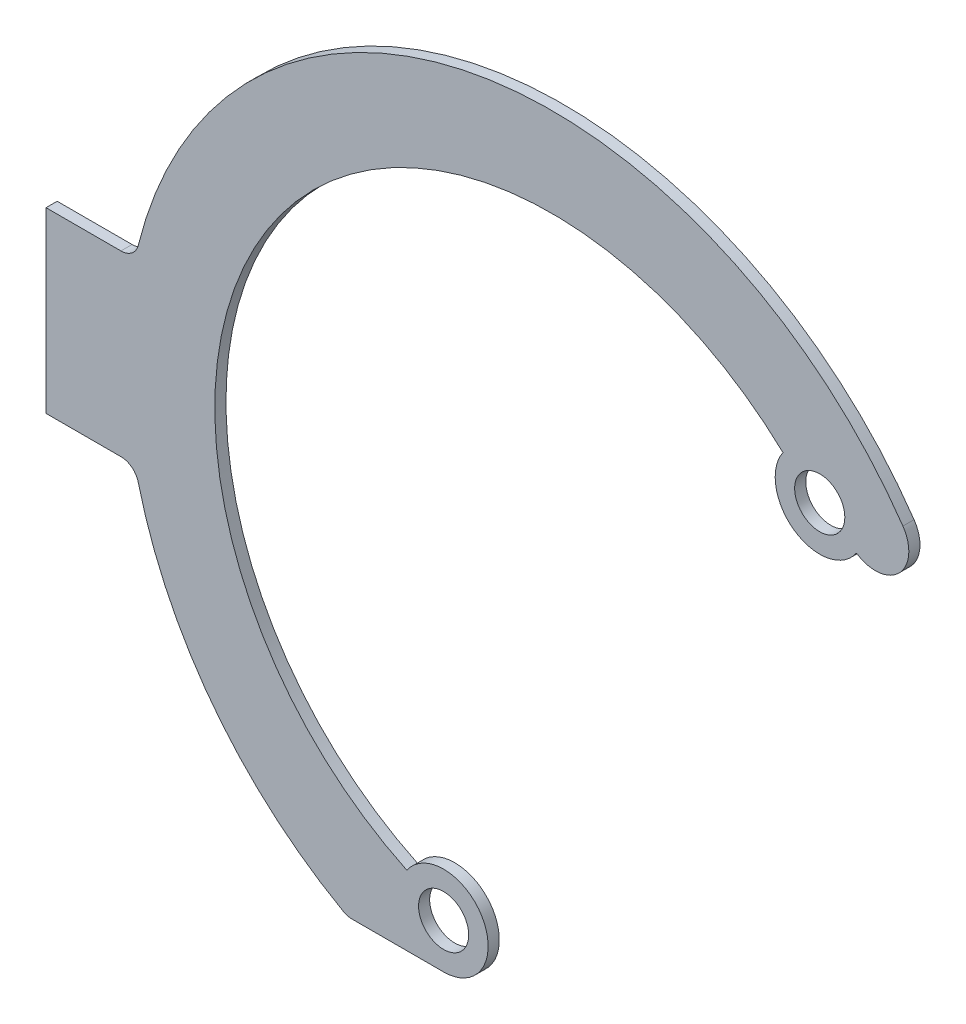
from build123d import *

# Parameters (mm, degrees)
SKETCH1_R           = 14.3002
BOSS_EXTRUDE1_DEPTH = 6.35
FILLET1_R           = 10.16


with BuildPart() as part:
    # Sketch1 → Boss-Extrude1 (new body)
    with BuildSketch(Plane.XY):
        with BuildLine():
            Line((-54.787568662, -25.4), (0, -25.4))
            ThreePointArc((0, -25.4), (22.465756024, 11.851152107), (-20.96418046, 14.340960136))
            ThreePointArc((-20.96418046, 14.340960136), (-96.891931571, 296.382201918), (193.491662983, 327.840960136))
            ThreePointArc((193.491662983, 327.840960136), (200.114883307, 292.53581954), (235.420023903, 299.159039864))
            ThreePointArc((235.420023903, 299.159039864), (259.695607277, 301.436411104), (261.893582664, 325.719311922))
            ThreePointArc((261.893582664, 325.719311922), (14.357413322, 426.207029502), (-175.89272439, 238.652179878))
            Line((-175.89272439, 238.652179878), (-226.69272439, 238.652179878))
            Line((-226.69272439, 238.652179878), (-226.69272439, 137.052179878))
            Line((-226.69272439, 137.052179878), (-175.89272439, 137.052179878))
            ThreePointArc((-175.89272439, 137.052179878), (-133.078613493, 42.602384317), (-54.787568662, -25.4))
        make_face()
        Circle(SKETCH1_R, mode=Mode.SUBTRACT)
        with Locations((214.455843443, 313.5)):
            Circle(SKETCH1_R, mode=Mode.SUBTRACT)
    extrude(amount=BOSS_EXTRUDE1_DEPTH)

    # Fillet1
    fillet1_edges = [part.edges().sort_by_distance(p)[0] for p in [
        (-54.787568662, -25.4, 3.175),
        (-175.89272439, 137.052179878, 3.175),
        (-175.89272439, 238.652179878, 3.175),
    ]]
    fillet(fillet1_edges, radius=FILLET1_R)


solid = part.part
